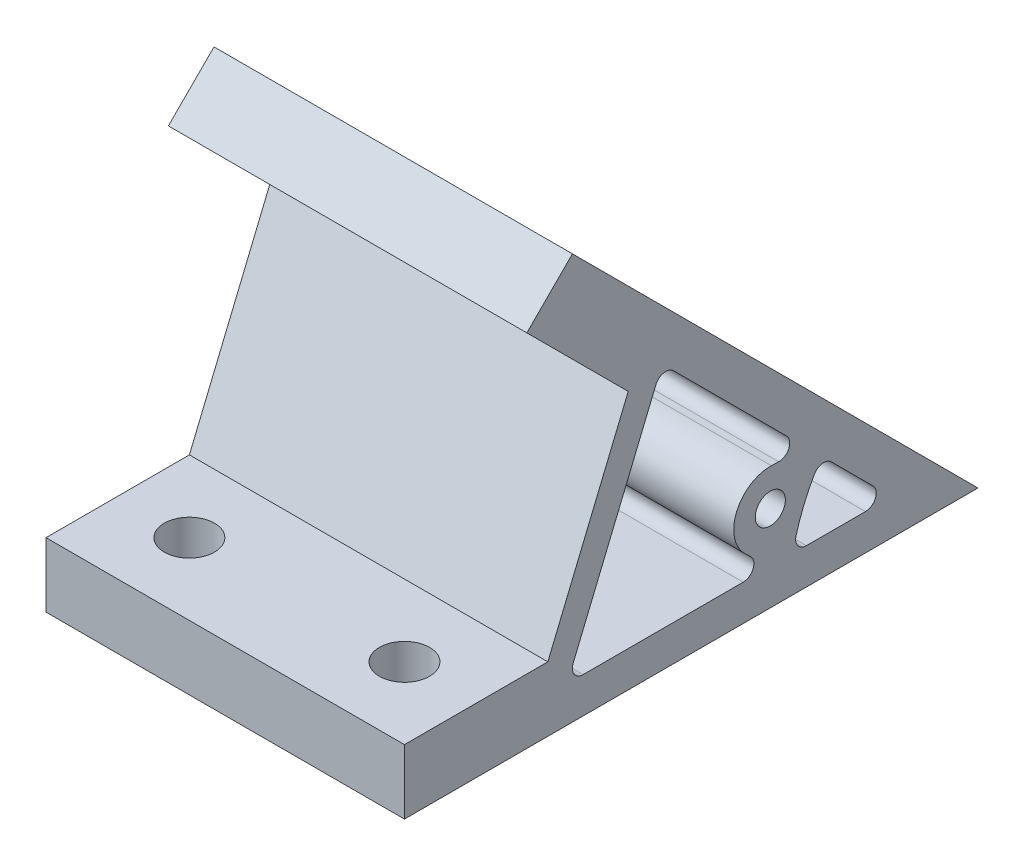
from build123d import *

# Parameters (mm, degrees)
BOSS_EXTRUDE1_DEPTH      = 25
BOSS_EXTRUDE1_DEPTH_BACK = 25
SKETCH1_R                = 2.1
SKETCH2_R                = 3.5
CUT_EXTRUDE1_DEPTH       = 9
SKETCH3_R                = 3.5
CUT_EXTRUDE2_DEPTH       = 9
SKETCH4_R                = 3.5
CUT_EXTRUDE3_DEPTH       = 9
SKETCH5_R                = 3.5
CUT_EXTRUDE4_DEPTH       = 9


with BuildPart() as part:
    # Sketch1 → Boss-Extrude1 (new, two sides: drawn at the far end of the back side and taken through both)
    with BuildSketch(Plane(origin=(0, 0, 0), x_dir=(0, 0, -1), z_dir=(1, 0, 0)).offset(-BOSS_EXTRUDE1_DEPTH_BACK)):
        Polygon((-80, 0), (0, 0), (-56.568542495, 56.568542495), (-62.932503526, 50.204581464), (-48.790367902, 36.062445841), (-60, 9), (-80, 9), align=None)
        with Locations((-28.970562748, 12)):
            Circle(SKETCH1_R, mode=Mode.SUBTRACT)
        with BuildLine():
            Line((-23.933031567, 5), (-15.692388155, 5))
            ThreePointArc((-15.692388155, 5), (-14.306568857, 5.925974851), (-14.631727984, 7.560660172))
            Line((-14.631727984, 7.560660172), (-20.458742822, 13.38767501))
            ThreePointArc((-20.458742822, 13.38767501), (-21.717716442, 13.813847638), (-22.820979835, 13.072600329))
            ThreePointArc((-22.820979835, 13.072600329), (-24.298031724, 10.064574227), (-25.38059396, 6.893145161))
            ThreePointArc((-25.38059396, 6.893145161), (-25.124609878, 5.588879191), (-23.933031567, 5))
        make_face(mode=Mode.SUBTRACT)
        with BuildLine():
            Line((-55.082376804, 5), (-32.755922357, 5))
            ThreePointArc((-32.755922357, 5), (-31.361417837, 5.947408702), (-31.728467606, 7.592857143))
            Line((-31.728467606, 7.592857143), (-32.463908902, 8.284285714))
            ThreePointArc((-32.463908902, 8.284285714), (-33.682348364, 13.951685505), (-28.813324734, 17.097575522))
            Line((-28.813324734, 17.097575522), (-27.804375375, 17.066453827))
            ThreePointArc((-27.804375375, 17.066453827), (-26.381324244, 17.970418197), (-26.697468729, 19.626400917))
            Line((-26.697468729, 19.626400917), (-42.484656068, 35.413588256))
            ThreePointArc((-42.484656068, 35.413588256), (-43.837951723, 35.824106005), (-44.931135539, 34.926953233))
            Line((-44.931135539, 34.926953233), (-56.468196103, 7.074025149))
            ThreePointArc((-56.468196103, 7.074025149), (-56.329581223, 5.66664465), (-55.082376804, 5))
        make_face(mode=Mode.SUBTRACT)
    extrude(amount=BOSS_EXTRUDE1_DEPTH + BOSS_EXTRUDE1_DEPTH_BACK)

    # Sketch2 → Cut-Extrude1 (cut)
    with BuildSketch(Plane(origin=(0, -6.363961031, 6.363961031), x_dir=(1, 0, 0), z_dir=(0, -0.7071067811865467, 0.7071067811865485))):
        with Locations((-15, 70)):
            Circle(SKETCH2_R)
    extrude(amount=-CUT_EXTRUDE1_DEPTH, mode=Mode.SUBTRACT)

    # Sketch3 → Cut-Extrude2 (cut)
    with BuildSketch(Plane(origin=(0, -6.363961031, 6.363961031), x_dir=(1, 0, 0), z_dir=(0, -0.7071067811865467, 0.7071067811865485))):
        with Locations((15, 70)):
            Circle(SKETCH3_R)
    extrude(amount=-CUT_EXTRUDE2_DEPTH, mode=Mode.SUBTRACT)

    # Sketch4 → Cut-Extrude3 (cut)
    with BuildSketch(Plane(origin=(0, 0, 0), x_dir=(1, 0, 0), z_dir=(0, 1, 0))):
        with Locations((-15, -70)):
            Circle(SKETCH4_R)
    extrude(amount=CUT_EXTRUDE3_DEPTH, mode=Mode.SUBTRACT)

    # Sketch5 → Cut-Extrude4 (cut)
    with BuildSketch(Plane(origin=(0, 0, 0), x_dir=(1, 0, 0), z_dir=(0, 1, 0))):
        with Locations((15, -70)):
            Circle(SKETCH5_R)
    extrude(amount=CUT_EXTRUDE4_DEPTH, mode=Mode.SUBTRACT)


solid = part.part
